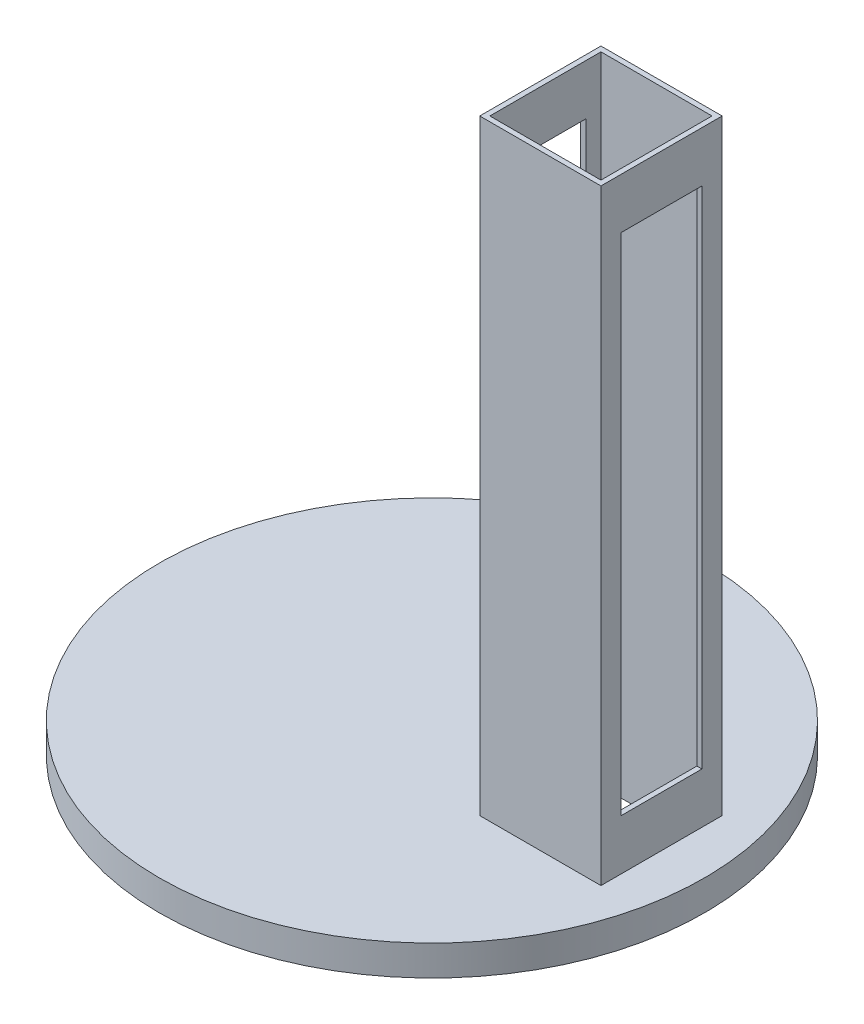
from build123d import *

# Parameters (mm, degrees)
SKETCH1_R           = 27
BOSS_EXTRUDE2_DEPTH = 3
SKETCH3_W           = 11
SKETCH3_H           = 11
CUT_EXTRUDE1_DEPTH  = 3
SKETCH5_W           = 12
SKETCH5_H           = 12
SKETCH5_W_2         = 11
SKETCH5_H_2         = 11
BOSS_EXTRUDE3_DEPTH = 60
SKETCH6_W           = 8
SKETCH6_H           = 50
CUT_EXTRUDE2_DEPTH  = 60


with BuildPart() as part:
    # Sketch1 → Boss-Extrude2 (new body)
    with BuildSketch(Plane(origin=(0, 0, 0), x_dir=(1, 0, 0), z_dir=(0, 1, 0))):
        with Locations(Location((0, 0, 0), (0, 0, 270))):
            Circle(SKETCH1_R)
    extrude(amount=BOSS_EXTRUDE2_DEPTH)

    # Sketch3 → Cut-Extrude1 (cut)
    with BuildSketch(Plane(origin=(0, 3, 0), x_dir=(1, 0, 0), z_dir=(0, 1, 0))):
        with Locations((16.527901815, 0.208370768)):
            Rectangle(SKETCH3_W, SKETCH3_H)
    extrude(amount=-CUT_EXTRUDE1_DEPTH, mode=Mode.SUBTRACT)

    # Sketch5 → Boss-Extrude3 (add)
    with BuildSketch(Plane(origin=(0, 3, 0), x_dir=(1, 0, 0), z_dir=(0, 1, 0))):
        with Locations((16.527901815, 0.208370768)):
            Rectangle(SKETCH5_W, SKETCH5_H)
        with Locations((16.527901815, 0.208370768)):
            Rectangle(SKETCH5_W_2, SKETCH5_H_2, mode=Mode.SUBTRACT)
    extrude(amount=BOSS_EXTRUDE3_DEPTH)

    # Sketch6 → Cut-Extrude2 (cut)
    with BuildSketch(Plane(origin=(22.527901815, 0, 0), x_dir=(0, 0, -1), z_dir=(1, 0, 0))):
        with Locations((0.208370768, 33)):
            Rectangle(SKETCH6_W, SKETCH6_H)
    extrude(amount=-CUT_EXTRUDE2_DEPTH, mode=Mode.SUBTRACT)


solid = part.part
